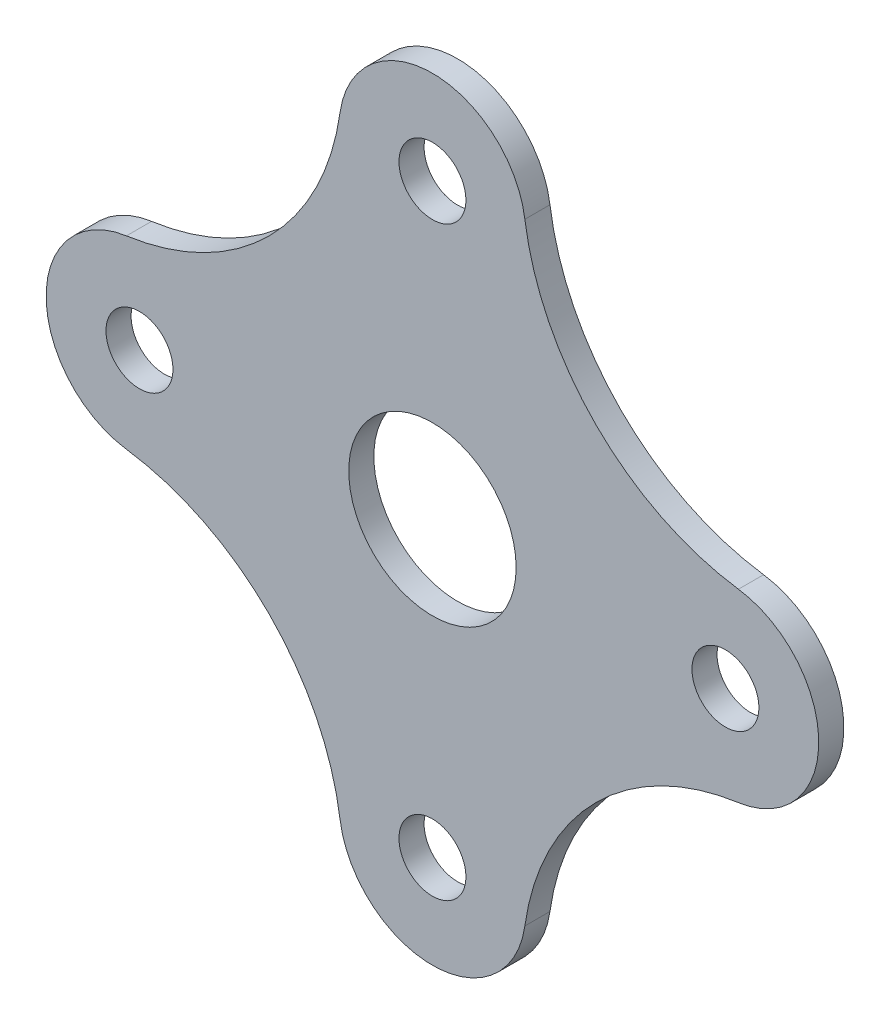
from build123d import *

# Parameters (mm, degrees)
SKETCH1_R           = 4
SKETCH1_R_2         = 10
BOSS_EXTRUDE1_DEPTH = 3
FILLET1_R           = 30


with BuildPart() as part:
    # Sketch1 → Boss-Extrude1 (new body)
    with BuildSketch(Plane.XY):
        with BuildLine():
            Line((-11.149584488, -35), (-11.149584488, -11.149584488))
            Line((-11.149584488, -11.149584488), (-35, -11.149584488))
            ThreePointArc((-35, -11.149584488), (-46.149584488, 0), (-35, 11.149584488))
            Line((-35, 11.149584488), (-11.149584488, 11.149584488))
            Line((-11.149584488, 11.149584488), (-11.149584488, 35))
            ThreePointArc((-11.149584488, 35), (0, 46.149584488), (11.149584488, 35))
            Line((11.149584488, 35), (11.149584488, 11.149584488))
            Line((11.149584488, 11.149584488), (35, 11.149584488))
            ThreePointArc((35, 11.149584488), (46.149584488, 0), (35, -11.149584488))
            Line((35, -11.149584488), (11.149584488, -11.149584488))
            Line((11.149584488, -11.149584488), (11.149584488, -35))
            ThreePointArc((11.149584488, -35), (0, -46.149584488), (-11.149584488, -35))
        make_face()
        with Locations((-35, 0)):
            Circle(SKETCH1_R, mode=Mode.SUBTRACT)
        with Locations((35, 0)):
            Circle(SKETCH1_R, mode=Mode.SUBTRACT)
        with Locations((0, 35)):
            Circle(SKETCH1_R, mode=Mode.SUBTRACT)
        with Locations((0, -35)):
            Circle(SKETCH1_R, mode=Mode.SUBTRACT)
        Circle(SKETCH1_R_2, mode=Mode.SUBTRACT)
    extrude(amount=BOSS_EXTRUDE1_DEPTH)

    # Fillet1
    fillet1_edges = [part.edges().sort_by_distance(p)[0] for p in [
        (-11.149584488, 11.149584488, 1.5),
        (11.149584488, 11.149584488, 1.5),
        (11.149584488, -11.149584488, 1.5),
        (-11.149584488, -11.149584488, 1.5),
    ]]
    fillet(fillet1_edges, radius=FILLET1_R)


solid = part.part
